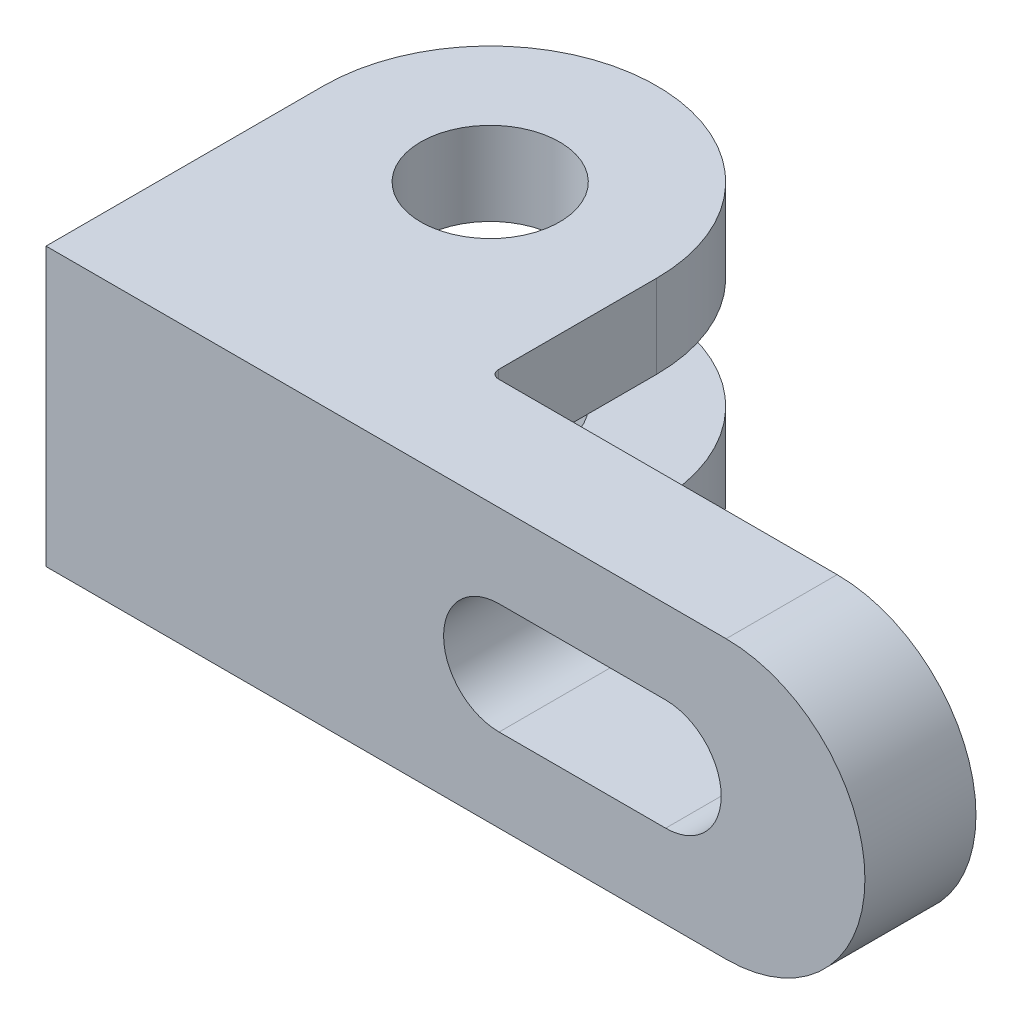
from build123d import *

# Parameters (mm, degrees)
SKETCH2_R           = 20
BOSS_EXTRUDE1_DEPTH = 8
CUT_EXTRUDE2_DEPTH  = 65.319514924
BOSS_EXTRUDE2_DEPTH = 12
SKETCH6_R           = 10
CUT_EXTRUDE3_DEPTH  = 91.647669578
FILLET2_R           = 1.2
FILLET3_R           = 1.2


with BuildPart() as part:
    # Sketch2 → Boss-Extrude1 (new, symmetric)
    with BuildSketch(Plane.XY):
        with BuildLine():
            Line((39, 20), (-59, 20))
            Line((-59, 20), (-59, -20))
            Line((-59, -20), (39, -20))
            ThreePointArc((39, -20), (19, 0), (39, 20))
        make_face()
        with Locations((39, 0)):
            Circle(SKETCH2_R)
    extrude(amount=BOSS_EXTRUDE1_DEPTH, both=True)

    # Sketch3 → Cut-Extrude2 (cut, through all)
    with BuildSketch(Plane.XY.offset(8)):
        with BuildLine():
            ThreePointArc((14.284953176, 0), (11.941807426, 5.656854249), (6.284953176, 8))
            Line((6.284953176, 8), (6.284953176, -8))
            ThreePointArc((6.284953176, -8), (11.941807426, -5.656854249), (14.284953176, 0))
        make_face()
        with BuildLine():
            Line((6.284953176, -8), (6.284953176, 8))
            ThreePointArc((6.284953176, 8), (-1.715046824, 0), (6.284953176, -8))
        make_face()
        with BuildLine():
            Line((30.284953176, 8), (6.284953176, 8))
            ThreePointArc((6.284953176, 8), (11.941807426, 5.656854249), (14.284953176, 0))
            ThreePointArc((14.284953176, 0), (11.941807426, -5.656854249), (6.284953176, -8))
            Line((6.284953176, -8), (30.284953176, -8))
            ThreePointArc((30.284953176, -8), (22.284953176, 0), (30.284953176, 8))
        make_face()
        with BuildLine():
            ThreePointArc((38.284953176, 0), (35.941807426, 5.656854249), (30.284953176, 8))
            Line((30.284953176, 8), (30.284953176, -8))
            ThreePointArc((30.284953176, -8), (35.941807426, -5.656854249), (38.284953176, 0))
        make_face()
        with BuildLine():
            Line((30.284953176, -8), (30.284953176, 8))
            ThreePointArc((30.284953176, 8), (22.284953176, 0), (30.284953176, -8))
        make_face()
    extrude(amount=-CUT_EXTRUDE2_DEPTH, mode=Mode.SUBTRACT)

    # Sketch5 → Boss-Extrude2 (add)
    with BuildSketch(Plane(origin=(0, 20, 0), x_dir=(1, 0, 0), z_dir=(0, 1, 0))):
        with BuildLine():
            ThreePointArc((-59, 32), (-51.970562748, 15.029437252), (-35, 8))
            ThreePointArc((-35, 8), (-18.029437252, 15.029437252), (-11, 32))
            Line((-11, 32), (-59, 32))
        make_face()
        with BuildLine():
            ThreePointArc((-11, 32), (-35, 56), (-59, 32))
            Line((-59, 32), (-11, 32))
        make_face()
        with BuildLine():
            Line((-59, 32), (-59, 8))
            Line((-59, 8), (-35, 8))
            ThreePointArc((-35, 8), (-51.970562748, 15.029437252), (-59, 32))
        make_face()
        with BuildLine():
            ThreePointArc((-11, 32), (-18.029437252, 15.029437252), (-35, 8))
            Line((-35, 8), (-11, 8))
            Line((-11, 8), (-11, 32))
        make_face()
    boss_extrude2 = extrude(amount=-BOSS_EXTRUDE2_DEPTH)

    # Sketch6 → Cut-Extrude3 (cut, through all)
    with BuildSketch(Plane(origin=(0, 20, 0), x_dir=(1, 0, 0), z_dir=(0, 1, 0))):
        with Locations(Location((-35, 32, 0), (0, 0, 180))):
            Circle(SKETCH6_R)
    cut_extrude3 = extrude(amount=-CUT_EXTRUDE3_DEPTH, mode=Mode.SUBTRACT)

    # Mirror1: Boss-Extrude2, Cut-Extrude3 across plane
    add(boss_extrude2.mirror(Plane.ZX))
    add(cut_extrude3.mirror(Plane.ZX), mode=Mode.SUBTRACT)

    # Fillet2
    fillet2_edges = [part.edges().sort_by_distance(p)[0] for p in [
        (-11, 14, -8),
    ]]
    fillet(fillet2_edges, radius=FILLET2_R)

    # Fillet3
    fillet3_edges = [part.edges().sort_by_distance(p)[0] for p in [
        (-11, -14, -8),
    ]]
    fillet(fillet3_edges, radius=FILLET3_R)


solid = part.part
